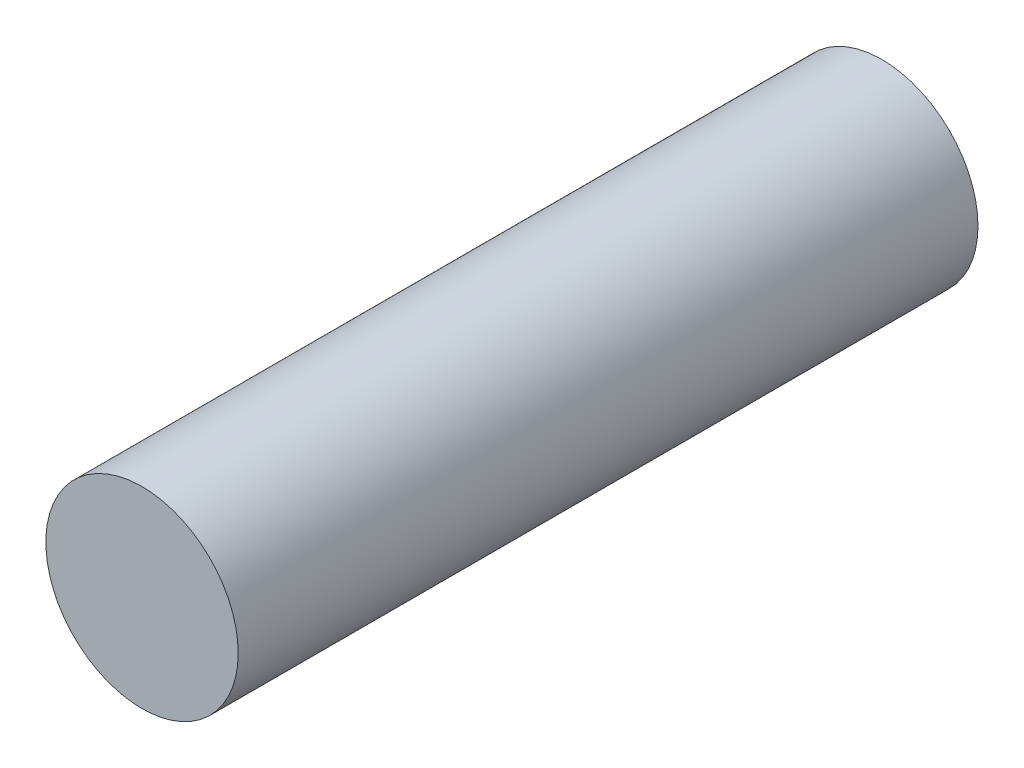
from build123d import *

# Parameters (mm, degrees)
SKETCH_1_R          = 13
SKETCH_1_R_2        = 10
EXTRUDE_1_DEPTH     = 100
EXTRUDE_START       = -5
SKETCH_2_R          = 13
EXTRUDE_2_DEPTH     = 5
SKETCH_3_R          = 1
CUT_EXTRUDE_1_DEPTH = 5


with BuildPart() as part:
    # 草图1 → 凸台-拉伸1 (new body)
    with BuildSketch(Plane.XY):
        Circle(SKETCH_1_R)
        Circle(SKETCH_1_R_2, mode=Mode.SUBTRACT)
    extrude(amount=EXTRUDE_1_DEPTH)

    # 草图2 → 凸台-拉伸2 (add)
    with BuildSketch(Plane.XY.offset(100).offset(EXTRUDE_START)):
        Circle(SKETCH_2_R)
    extrude(amount=EXTRUDE_2_DEPTH)

    # 草图3 → 切除-拉伸1 (cut)
    with BuildSketch(Plane(origin=(0, 0, 0), x_dir=(-1, 0, 0), z_dir=(0, 0, -1))):
        with Locations((0, 11.5)):
            Circle(SKETCH_3_R)
        with Locations((11.5, 0)):
            Circle(SKETCH_3_R)
        with Locations((0, -11.5)):
            Circle(SKETCH_3_R)
        with Locations((-11.5, 0)):
            Circle(SKETCH_3_R)
    extrude(amount=-CUT_EXTRUDE_1_DEPTH, mode=Mode.SUBTRACT)


solid = part.part
